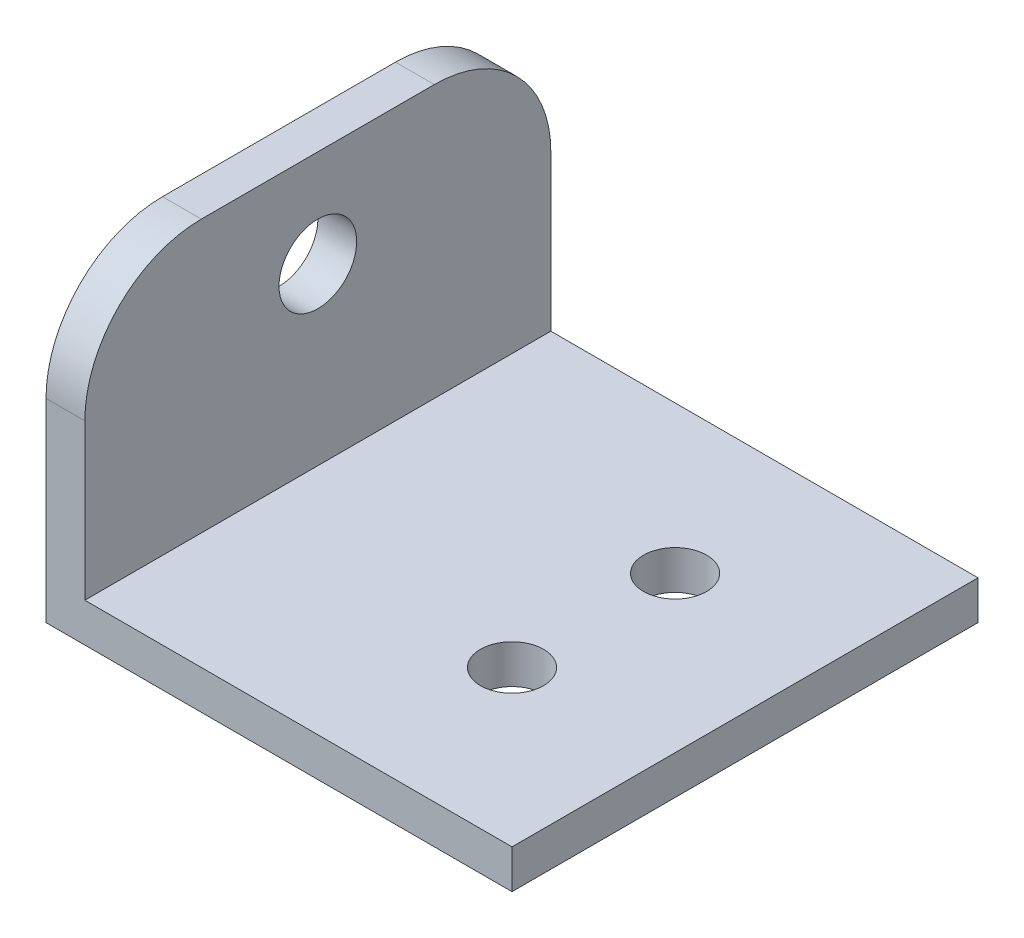
from build123d import *

# Parameters (mm, degrees)
BOSS_EXTRUDE1_DEPTH              = 38.1
F_13_64_0_20313_DIAMETER_HOLE1_D = 5.159375
F_1_4_0_25_DIAMETER_HOLE2_D      = 6.35
FILLET1_R                        = 9.525


with BuildPart() as part:
    # Sketch1 → Boss-Extrude1 (new body)
    with BuildSketch(Plane.XY):
        Polygon((0, 0), (0, 25.4), (3.175, 25.4), (3.175, 3.175), (38.1, 3.175), (38.1, 0), align=None)
    extrude(amount=BOSS_EXTRUDE1_DEPTH)

    # 13/64 (0.20313) Diameter Hole1 (through all)
    with Locations(Plane(origin=(0, 0, 0), x_dir=(-1, 0, 0), z_dir=(0, -1, 0))):
        with Locations((-25.4, -25.4), (-25.4, -12.065)):
            Hole(F_13_64_0_20313_DIAMETER_HOLE1_D / 2)

    # 1/4 (0.25) Diameter Hole2 (through all)
    with Locations(Plane.ZY):
        with Locations((19.05, 17.4625)):
            Hole(F_1_4_0_25_DIAMETER_HOLE2_D / 2)

    # Fillet1
    fillet1_edges = [part.edges().sort_by_distance(p)[0] for p in [
        (1.5875, 25.4, 38.1),
        (1.5875, 25.4, 0),
    ]]
    fillet(fillet1_edges, radius=FILLET1_R)


solid = part.part
